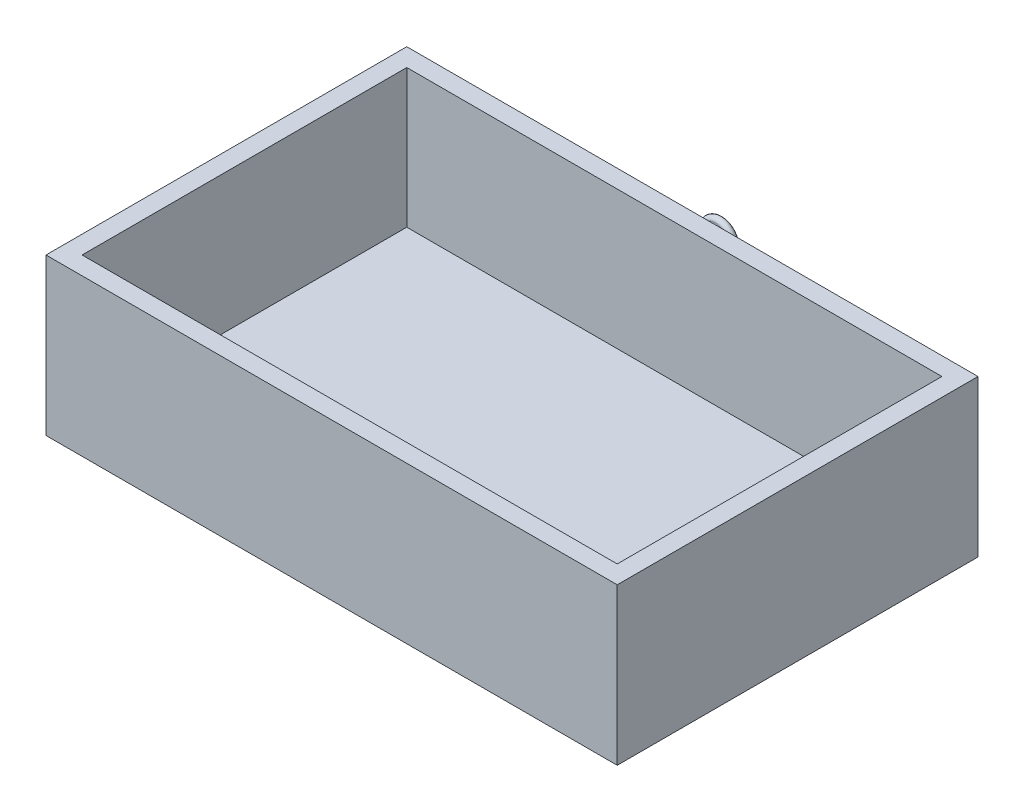
from build123d import *

# Parameters (mm, degrees)
SKETCH1_W           = 475
SKETCH1_H           = 130
BOSS_EXTRUDE1_DEPTH = 300
SHELL1_T            = -15


with BuildPart() as part:
    # Sketch1 → Boss-Extrude1 (new body)
    with BuildSketch(Plane.XY):
        with Locations((186.944444444, 54.744444444)):
            Rectangle(SKETCH1_W, SKETCH1_H)
    extrude(amount=BOSS_EXTRUDE1_DEPTH)

    # Shell1
    shell1_openings = [part.faces().sort_by_distance(p)[0] for p in [
        (186.944444444, 119.744444444, 150),
    ]]
    offset(amount=SHELL1_T, openings=shell1_openings, kind=Kind.INTERSECTION)

    # Sketch3 → Revolve2 (revolve)
    with BuildSketch(Plane.ZY.offset(-186.944444444), mode=Mode.PRIVATE) as revolve2_sk:
        with BuildLine():
            Line((0, 89.744444444), (-25, 89.744444444))
            Line((-25, 89.744444444), (-25, 102.114714247))
            ThreePointArc((-25, 102.114714247), (-22, 105.114714247), (-19, 102.114714247))
            ThreePointArc((-19, 102.114714247), (-17.535533906, 98.579180341), (-14, 97.114714247))
            Line((-14, 97.114714247), (0, 97.114714247))
            Line((0, 97.114714247), (0, 89.744444444))
        make_face()
    revolve(revolve2_sk.sketch.rotate(Axis((186.944444444, 89.744444444, 0), (0, 0, -1)), 90), axis=Axis((186.944444444, 89.744444444, 0), (0, 0, -1)))


solid = part.part
